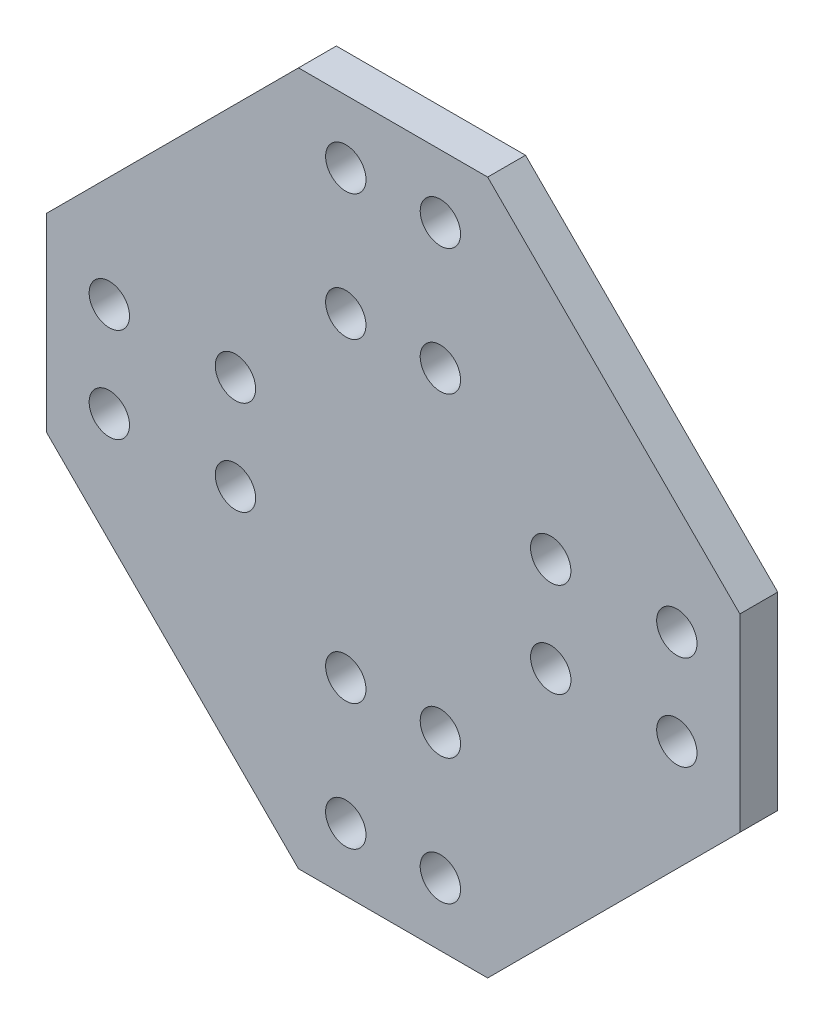
from build123d import *

# Parameters (mm, degrees)
EXTRUDE_1_DEPTH     = 3
SKETCH_2_R          = 1.6
CUT_EXTRUDE_1_DEPTH = 66.261014396


with BuildPart() as part:
    # 草图1 → 凸台-拉伸1 (new body)
    with BuildSketch(Plane.XY):
        Polygon((0, 0), (15, 0), (35, -20), (35, -35), (15, -55), (0, -55), (-20, -35), (-20, -20), align=None)
    extrude(amount=EXTRUDE_1_DEPTH)

    # 草图2 → 切除-拉伸1 (cut, through all)
    with BuildSketch(Plane(origin=(0, 0, 0), x_dir=(-1, 0, 0), z_dir=(0, 0, -1))):
        with Locations((-11.25, -5)):
            Circle(SKETCH_2_R)
        with Locations((-30, -31.25)):
            Circle(SKETCH_2_R)
        with Locations(Location((-30, -23.75, 0), (0, 0, 180))):
            Circle(SKETCH_2_R)
        with Locations(Location((-3.75, -5, 0), (0, 0, 180))):
            Circle(SKETCH_2_R)
        with Locations((-3.75, -15)):
            Circle(SKETCH_2_R)
        with Locations(Location((-11.25, -15, 0), (0, 0, 180))):
            Circle(SKETCH_2_R)
        with Locations((-20, -23.75)):
            Circle(SKETCH_2_R)
        with Locations(Location((-20, -31.25, 0), (0, 0, 180))):
            Circle(SKETCH_2_R)
        with Locations((5, -31.25)):
            Circle(SKETCH_2_R)
        with Locations(Location((5, -23.75, 0), (0, 0, 180))):
            Circle(SKETCH_2_R)
        with Locations((15, -23.75)):
            Circle(SKETCH_2_R)
        with Locations(Location((15, -31.25, 0), (0, 0, 180))):
            Circle(SKETCH_2_R)
        with Locations((-11.25, -40)):
            Circle(SKETCH_2_R)
        with Locations(Location((-3.75, -40, 0), (0, 0, 180))):
            Circle(SKETCH_2_R)
        with Locations((-3.75, -50)):
            Circle(SKETCH_2_R)
        with Locations(Location((-11.25, -50, 0), (0, 0, 180))):
            Circle(SKETCH_2_R)
    extrude(amount=-CUT_EXTRUDE_1_DEPTH, mode=Mode.SUBTRACT)


solid = part.part
